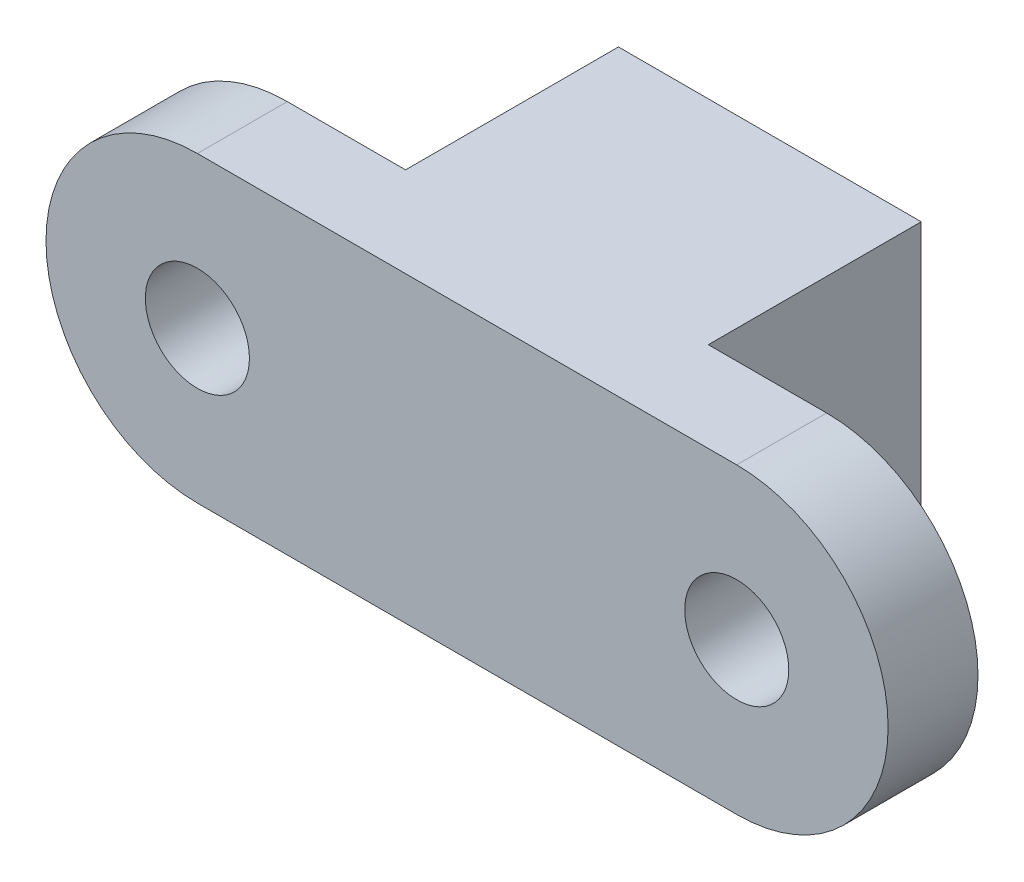
from build123d import *

# Parameters (mm, degrees)
SKETCH1_R           = 11
BOSS_EXTRUDE1_DEPTH = 19
SKETCH2_W           = 64
SKETCH2_H           = 64
BOSS_EXTRUDE2_DEPTH = 45
CUT_EXTRUDE8_START  = -13
CUT_EXTRUDE8_DEPTH  = 38


with BuildPart() as part:
    # Sketch1 → Boss-Extrude1 (new body)
    with BuildSketch(Plane.XY):
        with BuildLine():
            Line((0, 32), (114, 32))
            ThreePointArc((114, 32), (146, 0), (114, -32))
            Line((114, -32), (0, -32))
            ThreePointArc((0, -32), (-32, 0), (0, 32))
        make_face()
        Circle(SKETCH1_R, mode=Mode.SUBTRACT)
        with Locations((114, 0)):
            Circle(SKETCH1_R, mode=Mode.SUBTRACT)
    extrude(amount=BOSS_EXTRUDE1_DEPTH)

    # Sketch2 → Boss-Extrude2 (add)
    with BuildSketch(Plane(origin=(0, 0, 0), x_dir=(-1, 0, 0), z_dir=(0, 0, -1))):
        with Locations((-57, 0)):
            Rectangle(SKETCH2_W, SKETCH2_H)
    extrude(amount=BOSS_EXTRUDE2_DEPTH)

    # Sketch15 → Cut-Extrude8 (cut)
    with BuildSketch(Plane(origin=(89, 0, 0), x_dir=(0, 0, -1), z_dir=(1, 0, 0)).offset(CUT_EXTRUDE8_START)):
        Polygon((45, -32), (45, 19), (-6, -32), align=None)
    extrude(amount=-CUT_EXTRUDE8_DEPTH, mode=Mode.SUBTRACT)


solid = part.part
